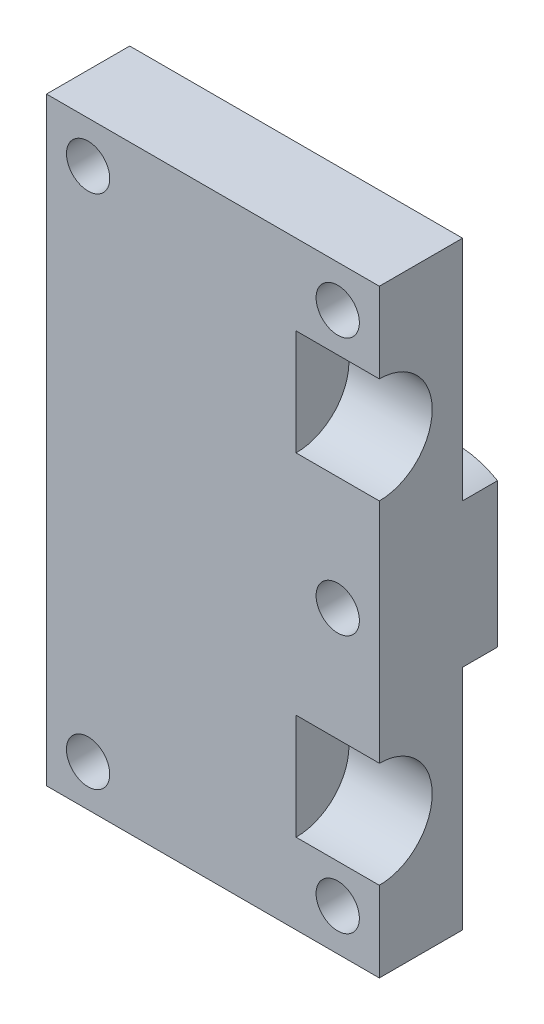
from build123d import *

# Parameters (mm, degrees)
SKETCH1_W           = 40
SKETCH1_H           = 10
BOSS_EXTRUDE1_DEPTH = 36
CUT_EXTRUDE1_DEPTH  = 10
SKETCH3_R           = 2.6
CUT_EXTRUDE2_DEPTH  = 55.735728734
BOSS_EXTRUDE2_START = 4.2
SKETCH5_R           = 2.6
BOSS_EXTRUDE2_DEPTH = 4.2


with BuildPart() as part:
    # Sketch1 → Boss-Extrude1 (new, symmetric)
    with BuildSketch(Plane(origin=(0, 0, 0), x_dir=(1, 0, 0), z_dir=(0, 1, 0))):
        with Locations((20, 5)):
            Rectangle(SKETCH1_W, SKETCH1_H)
    extrude(amount=BOSS_EXTRUDE1_DEPTH, both=True)

    # Sketch2 → Cut-Extrude1 (cut)
    with BuildSketch(Plane(origin=(40, 0, 0), x_dir=(0, 0, -1), z_dir=(1, 0, 0))):
        with BuildLine():
            Line((0, 26.35), (0, 13.65))
            ThreePointArc((0, 13.65), (6.35, 20), (0, 26.35))
        make_face()
        with BuildLine():
            Line((0, -13.65), (0, -26.35))
            ThreePointArc((0, -26.35), (6.35, -20), (0, -13.65))
        make_face()
    extrude(amount=-CUT_EXTRUDE1_DEPTH, mode=Mode.SUBTRACT)

    # Sketch3 → Cut-Extrude2 (cut, through all)
    with BuildSketch(Plane(origin=(0, 0, -10), x_dir=(-1, 0, 0), z_dir=(0, 0, -1))):
        with Locations((-35, 31)):
            Circle(SKETCH3_R)
        with Locations((-5, 31)):
            Circle(SKETCH3_R)
        with Locations((-35, -31)):
            Circle(SKETCH3_R)
        with Locations((-5, -31)):
            Circle(SKETCH3_R)
        with Locations((-35, 0)):
            Circle(SKETCH3_R)
    extrude(amount=-CUT_EXTRUDE2_DEPTH, mode=Mode.SUBTRACT)

    # Sketch5 → Boss-Extrude2 (add)
    with BuildSketch(Plane(origin=(0, 0, -10), x_dir=(-1, 0, 0), z_dir=(0, 0, -1)).offset(BOSS_EXTRUDE2_START)):
        with BuildLine():
            Line((-40, 8.660254038), (-40, -8.660254038))
            ThreePointArc((-40, -8.660254038), (-25, 0), (-40, 8.660254038))
        make_face()
        with Locations((-35, 0)):
            Circle(SKETCH5_R, mode=Mode.SUBTRACT)
    extrude(amount=-BOSS_EXTRUDE2_DEPTH)


solid = part.part
